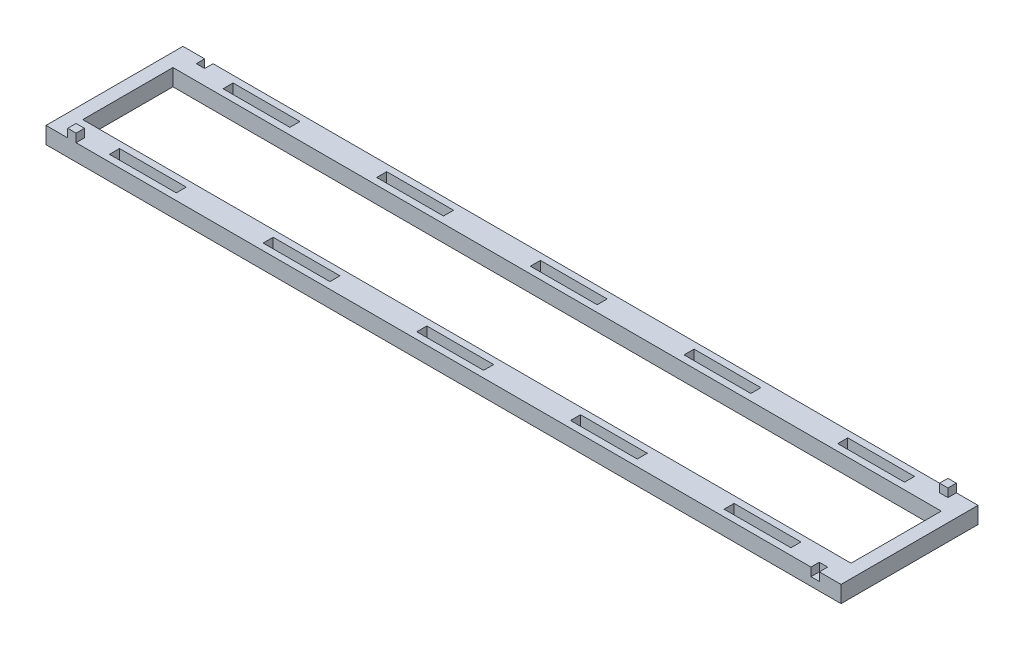
from build123d import *

# Parameters (mm, degrees)
SKETCH_1_W               = 238
SKETCH_1_H               = 41
SKETCH_1_W_2             = 230
SKETCH_1_H_2             = 27
EXTRUDE_1_DEPTH          = 5
SKETCH_2_W               = 20
SKETCH_2_H               = 3
CUT_EXTRUDE_1_DEPTH      = 3
MIRROR_2_COPY_1_SKETCH_W = 20
MIRROR_2_COPY_1_SKETCH_H = 3
MIRROR_2_COPY_1_DEPTH    = 3
SKETCH_3_W               = 2.5
SKETCH_3_H               = 2.5
EXTRUDE_2_DEPTH          = 2.5
SKETCH_3_3_W             = 2.5
SKETCH_3_3_H             = 2.5
CUT_EXTRUDE_2_DEPTH      = 2.5


with BuildPart() as part:
    # 草图1 → 凸台-拉伸1 (new body)
    with BuildSketch(Plane(origin=(0, 0, 0), x_dir=(1, 0, 0), z_dir=(0, 1, 0))):
        Rectangle(SKETCH_1_W, SKETCH_1_H)
        Rectangle(SKETCH_1_W_2, SKETCH_1_H_2, mode=Mode.SUBTRACT)
    extrude(amount=EXTRUDE_1_DEPTH)

    # 草图2 → 切除-拉伸1 (cut)
    with BuildSketch(Plane(origin=(0, 5, 0), x_dir=(1, 0, 0), z_dir=(0, 1, 0))):
        with Locations((0, 17)):
            Rectangle(SKETCH_2_W, SKETCH_2_H)
        with Locations((46, 17)):
            Rectangle(SKETCH_2_W, SKETCH_2_H)
        with Locations((92, 17)):
            Rectangle(SKETCH_2_W, SKETCH_2_H)
    cut_extrude_1 = extrude(amount=-CUT_EXTRUDE_1_DEPTH, mode=Mode.SUBTRACT)

    # 镜向1: 切除-拉伸1 across plane
    add(cut_extrude_1.mirror(Plane.XY), mode=Mode.SUBTRACT)

    # 镜向2: 切除-拉伸1 across plane
    add(cut_extrude_1.mirror(Plane(origin=(0, 0, 0), x_dir=(0, 0, 1), z_dir=(1, 0, 0))), mode=Mode.SUBTRACT)

    # 镜向2 copy 1 sketch → 镜向2 copy 1 (cut)
    with BuildSketch(Plane(origin=(0, 5, 0), x_dir=(-1, 0, 0), z_dir=(0, 1, 0))):
        with Locations((0, 17)):
            Rectangle(MIRROR_2_COPY_1_SKETCH_W, MIRROR_2_COPY_1_SKETCH_H)
        with Locations((46, 17)):
            Rectangle(MIRROR_2_COPY_1_SKETCH_W, MIRROR_2_COPY_1_SKETCH_H)
        with Locations((92, 17)):
            Rectangle(MIRROR_2_COPY_1_SKETCH_W, MIRROR_2_COPY_1_SKETCH_H)
    extrude(amount=-MIRROR_2_COPY_1_DEPTH, mode=Mode.SUBTRACT)

    # 草图3 → 凸台-拉伸2 (add)
    with BuildSketch(Plane(origin=(0, 5, 0), x_dir=(1, 0, 0), z_dir=(0, 1, 0))):
        with Locations((111.25, 19.25)):
            Rectangle(SKETCH_3_W, SKETCH_3_H)
        with Locations((-111.25, -19.25)):
            Rectangle(SKETCH_3_W, SKETCH_3_H)
    extrude(amount=EXTRUDE_2_DEPTH)

    # 草图3<3> → 切除-拉伸2 (cut)
    with BuildSketch(Plane(origin=(0, 5, 0), x_dir=(1, 0, 0), z_dir=(0, 1, 0))):
        with Locations((-111.25, 19.25)):
            Rectangle(SKETCH_3_3_W, SKETCH_3_3_H)
        with Locations((111.25, -19.25)):
            Rectangle(SKETCH_3_3_W, SKETCH_3_3_H)
    extrude(amount=-CUT_EXTRUDE_2_DEPTH, mode=Mode.SUBTRACT)


solid = part.part
